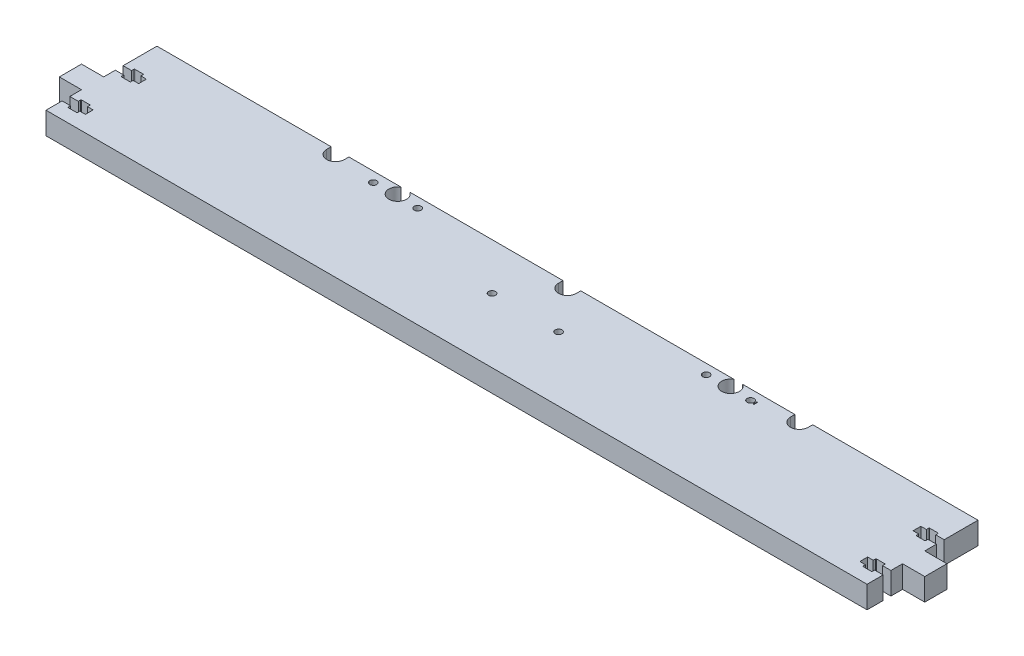
from build123d import *

# Parameters (mm, degrees)
MAINBODY_DEPTH                 = 10
SCREWCUTOUTS_DEPTH             = 197.85019685
SKETCH3_R                      = 4
SKETCH3_R_2                    = 1.55
RODCUTOUTS_DEPTH               = 197.85019685
SKETCH6_R                      = 1.55
CUT_EXTRUDE1_DEPTH             = 197.85019685
BEDADJUSTMENTSCREWCUTOUT_DEPTH = 197.85019685
DIRECTIONKEY_DEPTH             = 197.85019685
CUT_EXTRUDE2_DEPTH             = 197.85019685


with BuildPart() as part:
    # Sketch1 → MainBody (new body)
    with BuildSketch(Plane(origin=(0, 0, 0), x_dir=(1, 0, 0), z_dir=(0, 1, 0))):
        Polygon((0, 25), (0, -25), (-185, -25), (-185, -9), (-195, -9), (-195, 1), (-185, 1), (-185, 25), align=None)
    mainbody = extrude(amount=MAINBODY_DEPTH)

    # Sketch5 → ScrewCutouts (cut, through all)
    with BuildSketch(Plane(origin=(0, 10, 0), x_dir=(1, 0, 0), z_dir=(0, 1, 0))):
        with BuildLine():
            Line((-185, 9.75), (-181.2, 9.75))
            Line((-181.2, 9.75), (-181.2, 10.75))
            ThreePointArc((-181.2, 10.75), (-181.126776695, 10.926776695), (-180.95, 11))
            Line((-180.95, 11), (-177.25, 11))
            ThreePointArc((-177.25, 11), (-177.073223305, 10.926776695), (-177, 10.75))
            Line((-177, 10.75), (-177, 9.75))
            Line((-177, 9.75), (-174.5, 9.75))
            Line((-174.5, 9.75), (-174.5, 6.25))
            Line((-174.5, 6.25), (-177, 6.25))
            Line((-177, 6.25), (-177, 5.25))
            ThreePointArc((-177, 5.25), (-177.073223305, 5.073223305), (-177.25, 5))
            Line((-177.25, 5), (-180.95, 5))
            ThreePointArc((-180.95, 5), (-181.126776695, 5.073223305), (-181.2, 5.25))
            Line((-181.2, 5.25), (-181.2, 6.25))
            Line((-181.2, 6.25), (-185, 6.25))
            Line((-185, 6.25), (-185, 9.75))
        make_face()
        with BuildLine():
            Line((-185, -14.25), (-181.2, -14.25))
            Line((-181.2, -14.25), (-181.2, -13.25))
            ThreePointArc((-181.2, -13.25), (-181.126776695, -13.073223305), (-180.95, -13))
            Line((-180.95, -13), (-177.25, -13))
            ThreePointArc((-177.25, -13), (-177.073223305, -13.073223305), (-177, -13.25))
            Line((-177, -13.25), (-177, -14.25))
            Line((-177, -14.25), (-174.5, -14.25))
            Line((-174.5, -14.25), (-174.5, -17.75))
            Line((-174.5, -17.75), (-177, -17.75))
            Line((-177, -17.75), (-177, -18.75))
            ThreePointArc((-177, -18.75), (-177.073223305, -18.926776695), (-177.25, -19))
            Line((-177.25, -19), (-180.95, -19))
            ThreePointArc((-180.95, -19), (-181.126776695, -18.926776695), (-181.2, -18.75))
            Line((-181.2, -18.75), (-181.2, -17.75))
            Line((-181.2, -17.75), (-185, -17.75))
            Line((-185, -17.75), (-185, -14.25))
        make_face()
    screwcutouts = extrude(amount=-SCREWCUTOUTS_DEPTH, mode=Mode.SUBTRACT)

    # Mirror1: MainBody, ScrewCutouts across plane
    add(mainbody.mirror(Plane(origin=(0, 0, 0), x_dir=(0, 0, 1), z_dir=(1, 0, 0))))
    add(screwcutouts.mirror(Plane(origin=(0, 0, 0), x_dir=(0, 0, 1), z_dir=(1, 0, 0))), mode=Mode.SUBTRACT)

    # Sketch3 → RodCutouts (cut, through all)
    with BuildSketch(Plane(origin=(0, 10, 0), x_dir=(1, 0, 0), z_dir=(0, 1, 0))):
        with Locations((-73, 21.5)):
            Circle(SKETCH3_R)
        with Locations(Location((-83, 20.5, 0), (0, 0, 270))):
            Circle(SKETCH3_R_2)
        with Locations(Location((-63, 20.5, 0), (0, 0, 90))):
            Circle(SKETCH3_R_2)
        with Locations(Location((67, 20.5, 0), (0, 0, 270))):
            Circle(SKETCH3_R_2)
        with Locations(Location((87, 20.5, 0), (0, 0, 90))):
            Circle(SKETCH3_R_2)
        with Locations((77, 21.5)):
            Circle(SKETCH3_R)
    extrude(amount=-RODCUTOUTS_DEPTH, mode=Mode.SUBTRACT)

    # Sketch6 → Cut-Extrude1 (cut, through all)
    with BuildSketch(Plane(origin=(0, 10, 0), x_dir=(1, 0, 0), z_dir=(0, 1, 0))):
        with Locations(Location((-13, 4, 0), (0, 0, 270))):
            Circle(SKETCH6_R)
        with Locations(Location((17, 4, 0), (0, 0, 90))):
            Circle(SKETCH6_R)
    extrude(amount=-CUT_EXTRUDE1_DEPTH, mode=Mode.SUBTRACT)

    # Sketch7 → BedAdjustmentScrewCutout (cut, through all)
    with BuildSketch(Plane(origin=(0, 10, 0), x_dir=(1, 0, 0), z_dir=(0, 1, 0))):
        with BuildLine():
            Line((-98.5, 25), (-98.5, 23))
            ThreePointArc((-98.5, 23), (-102.5, 19), (-106.5, 23))
            Line((-106.5, 23), (-106.5, 25))
            ThreePointArc((-106.5, 25), (-102.5, 29), (-98.5, 25))
        make_face()
        with BuildLine():
            Line((102.5, 25), (102.5, 23))
            ThreePointArc((102.5, 23), (106.5, 19), (110.5, 23))
            Line((110.5, 23), (110.5, 25))
            ThreePointArc((110.5, 25), (106.5, 29), (102.5, 25))
        make_face()
    extrude(amount=-BEDADJUSTMENTSCREWCUTOUT_DEPTH, mode=Mode.SUBTRACT)

    # Sketch8 → DirectionKey (cut, through all)
    with BuildSketch(Plane(origin=(0, 10, 0), x_dir=(1, 0, 0), z_dir=(0, 1, 0))):
        Polygon((88.35, 20.5), (89.35, 21.5), (89.35, 19.5), align=None)
    extrude(amount=-DIRECTIONKEY_DEPTH, mode=Mode.SUBTRACT)

    # Sketch9 → Cut-Extrude2 (cut, through all)
    with BuildSketch(Plane(origin=(0, 10, 0), x_dir=(1, 0, 0), z_dir=(0, 1, 0))):
        with BuildLine():
            Line((6, 27), (6, 23))
            ThreePointArc((6, 23), (2, 19), (-2, 23))
            Line((-2, 23), (-2, 27))
            ThreePointArc((-2, 27), (2, 31), (6, 27))
        make_face()
    extrude(amount=-CUT_EXTRUDE2_DEPTH, mode=Mode.SUBTRACT)


solid = part.part
